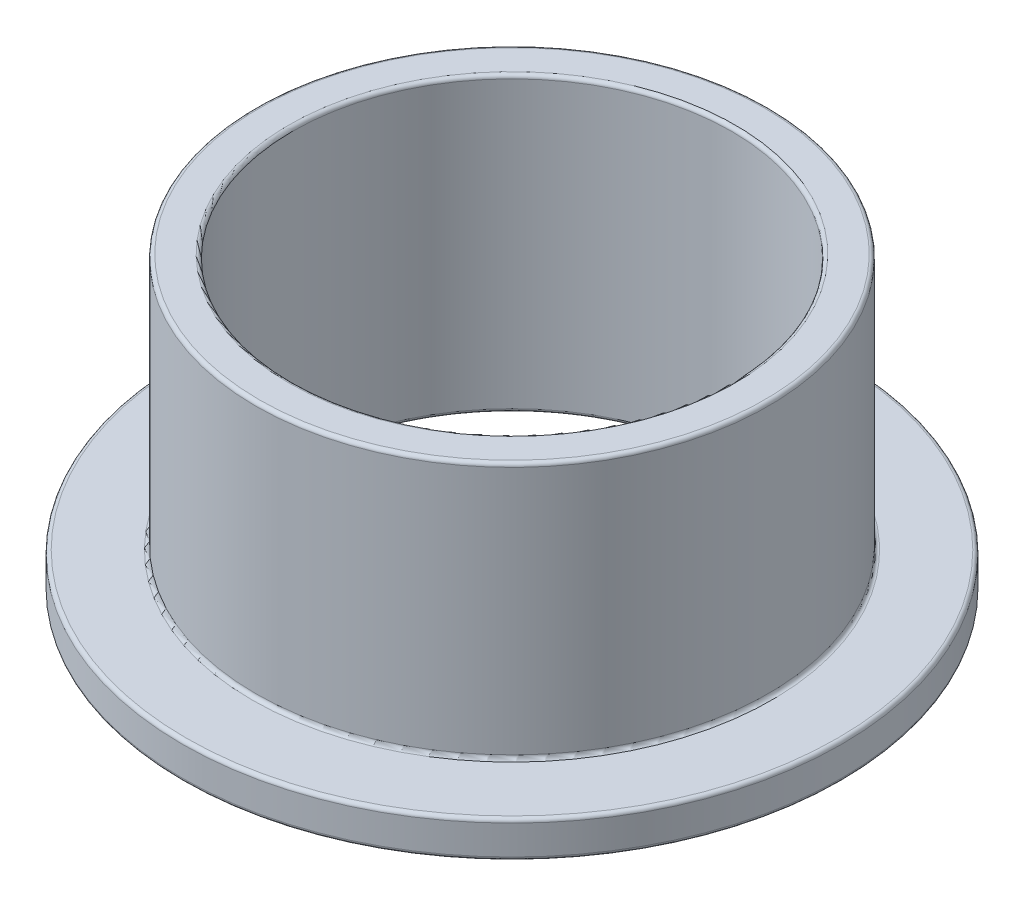
from build123d import *

# Parameters (mm, degrees)
SKETCH3_R           = 11.1125
SKETCH3_R_2         = 9.525
BOSS_EXTRUDE1_DEPTH = 12.7
SKETCH4_R           = 14.2875
SKETCH4_R_2         = 11.1125
BOSS_EXTRUDE2_DEPTH = 1.5875
FILLET1_R           = 0.15875


with BuildPart() as part:
    # Sketch3 → Boss-Extrude1 (new body)
    with BuildSketch(Plane(origin=(0, 0, 0), x_dir=(1, 0, 0), z_dir=(0, 1, 0))):
        with Locations(Location((0, 0, 0), (0, 0, 270))):
            Circle(SKETCH3_R)
        with Locations(Location((0, 0, 0), (0, 0, 270))):
            Circle(SKETCH3_R_2, mode=Mode.SUBTRACT)
    extrude(amount=BOSS_EXTRUDE1_DEPTH)

    # Sketch4 → Boss-Extrude2 (add)
    with BuildSketch(Plane(origin=(0, 0, 0), x_dir=(1, 0, 0), z_dir=(0, 1, 0))):
        with Locations(Location((0, 0, 0), (0, 0, 270))):
            Circle(SKETCH4_R)
        with Locations(Location((0, 0, 0), (0, 0, 270))):
            Circle(SKETCH4_R_2, mode=Mode.SUBTRACT)
    extrude(amount=BOSS_EXTRUDE2_DEPTH)

    # Fillet1
    fillet1_edges = [part.edges().sort_by_distance(p)[0] for p in [
        (0, 0, -14.2875),
        (0, 1.5875, -11.1125),
        (0, 12.7, -11.1125),
        (0, 0, -9.525),
        (0, 12.7, -9.525),
        (0, 1.5875, -14.2875),
    ]]
    fillet(fillet1_edges, radius=FILLET1_R)


solid = part.part
